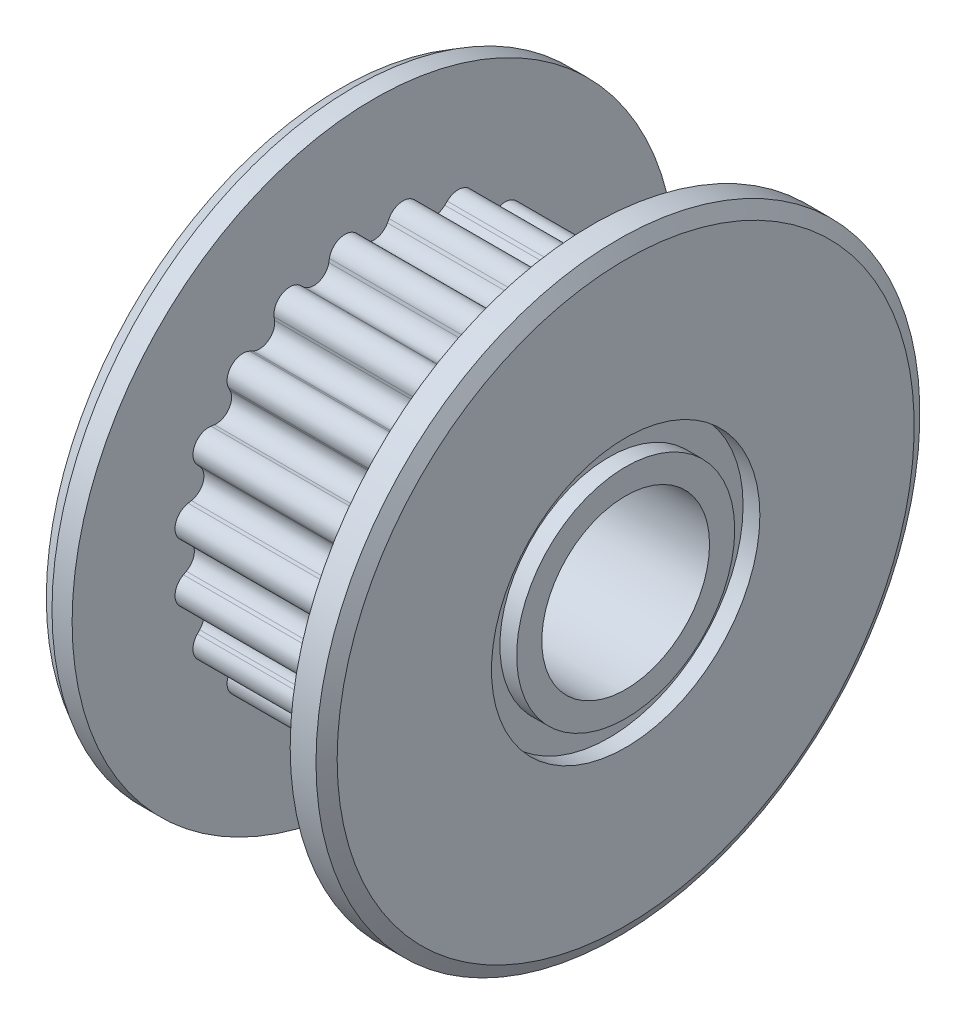
from build123d import *
from OCP.BRepFilletAPI import BRepFilletAPI_MakeChamfer

# Parameters (mm, degrees)
CHAMFER1_SIZE      = 0.4
CHAMFER1_SIZE2     = 0.230940108
SKETCH2_R          = 2.5
CUT_EXTRUDE1_DEPTH = 16.305227865
SKETCH3_R          = 4
SKETCH3_R_2        = 3.25
CUT_EXTRUDE2_DEPTH = 0.5
CUT_EXTRUDE3_START = -0.5
SKETCH4_R          = 4
SKETCH4_R_2        = 3.25
CUT_EXTRUDE3_DEPTH = 0.5
CUT_EXTRUDE4_START = -1
CUT_EXTRUDE4_DEPTH = 6.5
CIRPATTERN1_COUNT  = 20


with BuildPart() as part:
    # Sketch1 → Revolve1 (revolve)
    with BuildSketch(Plane.XY):
        Polygon((0, 0), (0, 9), (1, 9), (1, 6), (7.5, 6), (7.5, 9), (8.5, 9), (8.5, 0), align=None)
    revolve(axis=Axis((0, 0, 0), (1, 0, 0)))

    # Chamfer1: one chamfer whose edges measure the first distance from different faces: ONE call of the kernel's chamfer builder (chamfer() names one face for all edges)
    chamfer1_edges_1 = [part.edges().sort_by_distance(p)[0] for p in [
        (0, -9, 0),
    ]]
    chamfer1_side_1 = [part.faces().sort_by_distance(p)[0] for p in [
        (0.5, -9, 0),
    ]]
    chamfer1_edges_2 = [part.edges().sort_by_distance(p)[0] for p in [
        (8.5, -9, 0),
    ]]
    chamfer1_side_2 = [part.faces().sort_by_distance(p)[0] for p in [
        (8.5, 0, 0),
    ]]
    chamfer1 = BRepFilletAPI_MakeChamfer(part.part.solid().wrapped)
    for e in chamfer1_edges_1:
        chamfer1.Add(CHAMFER1_SIZE, CHAMFER1_SIZE2, e.wrapped, chamfer1_side_1[0].wrapped)  # the first distance lies on this face
    for e in chamfer1_edges_2:
        chamfer1.Add(CHAMFER1_SIZE, CHAMFER1_SIZE2, e.wrapped, chamfer1_side_2[0].wrapped)  # the first distance lies on this face
    add(Compound.cast(chamfer1.Shape()), mode=Mode.REPLACE)

    # Sketch2 → Cut-Extrude1 (cut, through all)
    with BuildSketch(Plane(origin=(8.5, 0, 0), x_dir=(0, 0, -1), z_dir=(1, 0, 0))):
        Circle(SKETCH2_R)
    extrude(amount=-CUT_EXTRUDE1_DEPTH, mode=Mode.SUBTRACT)

    # Sketch3 → Cut-Extrude2 (cut)
    with BuildSketch(Plane(origin=(8.5, 0, 0), x_dir=(0, 0, -1), z_dir=(1, 0, 0))):
        Circle(SKETCH3_R)
        Circle(SKETCH3_R_2, mode=Mode.SUBTRACT)
    extrude(amount=-CUT_EXTRUDE2_DEPTH, mode=Mode.SUBTRACT)

    # Sketch4 → Cut-Extrude3 (cut)
    with BuildSketch(Plane.ZY.offset(CUT_EXTRUDE3_START)):
        Circle(SKETCH4_R)
        Circle(SKETCH4_R_2, mode=Mode.SUBTRACT)
    extrude(amount=CUT_EXTRUDE3_DEPTH, mode=Mode.SUBTRACT)

    # Sketch5 → Cut-Extrude4 (cut)
    with BuildSketch(Plane(origin=(8.5, 0, 0), x_dir=(0, 0, -1), z_dir=(1, 0, 0)).offset(CUT_EXTRUDE4_START)):
        with BuildLine():
            Line((-0.399467443, 5.594643379), (-0.447274199, 5.683157544))
            ThreePointArc((-0.447274199, 5.683157544), (-0.654270663, 5.882840909), (-0.93860679, 5.926130044))
            ThreePointArc((-0.93860679, 5.926130044), (0, 6), (0.93860679, 5.926130044))
            ThreePointArc((0.93860679, 5.926130044), (0.654270663, 5.882840909), (0.447274199, 5.683157544))
            Line((0.447274199, 5.683157544), (0.399467443, 5.594643379))
            ThreePointArc((0.399467443, 5.594643379), (0, 5.356388285), (-0.399467443, 5.594643379))
        make_face()
    cut_extrude4 = extrude(amount=-CUT_EXTRUDE4_DEPTH, mode=Mode.SUBTRACT)

    # CirPattern1: Cut-Extrude4 ×20 about axis
    cirpattern1_axis = Axis((0, 0, 0), (1, 0, 0))
    for i in range(1, CIRPATTERN1_COUNT):
        add(cut_extrude4.rotate(cirpattern1_axis, i * 360 / CIRPATTERN1_COUNT), mode=Mode.SUBTRACT)


solid = part.part
